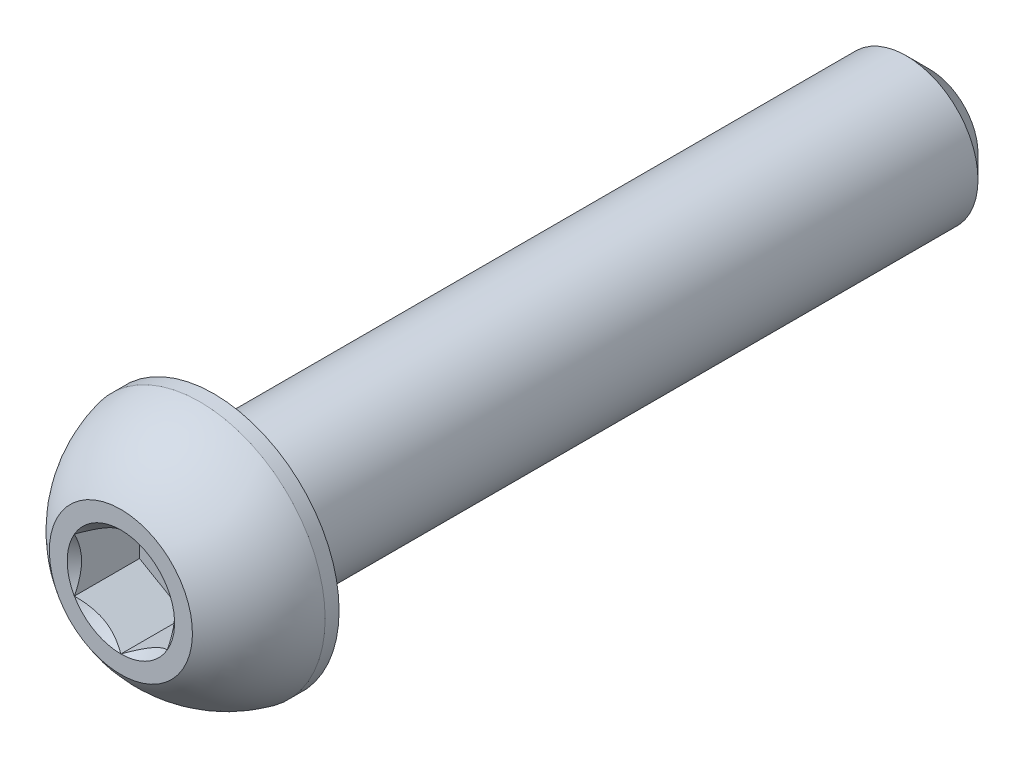
from build123d import *

# Parameters (mm, degrees)
CUT_EXTRUDE1_DEPTH = 0.91


with BuildPart() as part:
    # Sketch2 → Revolve1 (revolve)
    with BuildSketch(Plane(origin=(0, 0, 0), x_dir=(0, 0, -1), z_dir=(1, 0, 0)), mode=Mode.PRIVATE) as revolve1_sk:
        with BuildLine():
            Line((-5.65, 0), (5.65, 0))
            Line((5.65, 0), (5.65, 0.68))
            Line((5.65, 0.68), (5.33, 1))
            Line((5.33, 1), (-4.35, 1))
            Line((-4.35, 1), (-4.35, 1.75))
            Line((-4.35, 1.75), (-4.545, 1.75))
            ThreePointArc((-4.545, 1.75), (-5.170023043, 1.481850617), (-5.65, 1))
            Line((-5.65, 1), (-5.65, 0))
        make_face()
    revolve(revolve1_sk.sketch.rotate(Axis((0, 0, 5.65), (0, 0, -1)), 90), axis=Axis((0, 0, 5.65), (0, 0, -1)))

    # Sketch3 → Cut-Extrude1 (cut)
    with BuildSketch(Plane.XY.offset(5.65)):
        Polygon((0, 0.75055535), (-0.65, 0.375277675), (-0.65, -0.375277675), (0, -0.75055535), (0.65, -0.375277675), (0.65, 0.375277675), align=None)
    extrude(amount=-CUT_EXTRUDE1_DEPTH, mode=Mode.SUBTRACT)

    # Cut-Extrude2 cone 1 section (through the dimple's axis) → Cut-Extrude2 (revolve, cut)
    with BuildSketch(Plane(origin=(0, 0, 5.65), x_dir=(0, -1, 0), z_dir=(1, 0, 0))):
        Polygon((0, 0), (0.75055535, 0), (0, 0.75055535), align=None)
    revolve(axis=Axis((0, 0, 5.65), (0, 0, -1)), mode=Mode.SUBTRACT)


solid = part.part
